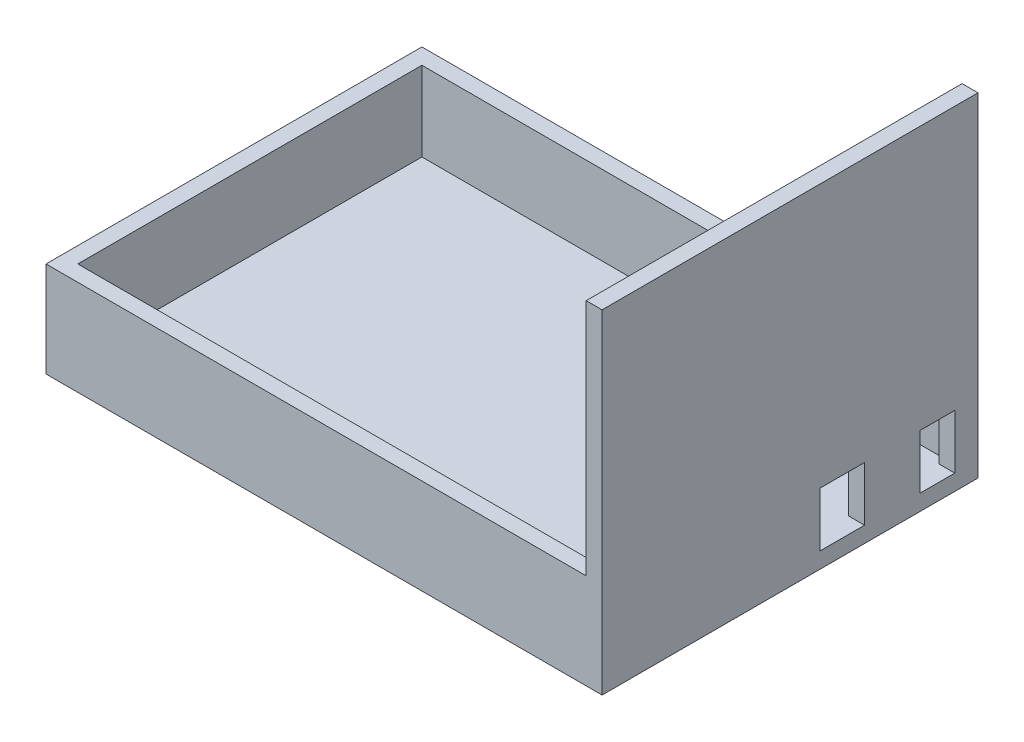
from build123d import *

# Parameters (mm, degrees)
SZKIC1_W                    = 175
SZKIC1_H                    = 118.3
DODANIE_WYCI_GNI_CIE1_DEPTH = 5
SZKIC2_W                    = 5
SZKIC2_H                    = 118.3
DODANIE_WYCI_GNI_CIE2_DEPTH = 25
SZKIC3_W                    = 5
SZKIC3_H                    = 118.3
DODANIE_WYCI_GNI_CIE3_DEPTH = 100
SZKIC4_W                    = 165
SZKIC4_H                    = 5
DODANIE_WYCI_GNI_CIE4_DEPTH = 25
SZKIC5_W                    = 165
SZKIC5_H                    = 5
DODANIE_WYCI_GNI_CIE5_DEPTH = 25
WYTNIJ_WYCI_GNI_CIE1_REACH  = 214.482
SZKIC7_W                    = 14
SZKIC7_H                    = 17.1
WYTNIJ_WYCI_GNI_CIE2_REACH  = 214.482
SZKIC8_W                    = 10.9
SZKIC8_H                    = 17.1


with BuildPart() as part:
    # Szkic1 → Dodanie-wyciągnięcie1 (new body)
    with BuildSketch(Plane(origin=(0, 0, 0), x_dir=(1, 0, 0), z_dir=(0, 1, 0))):
        Rectangle(SZKIC1_W, SZKIC1_H)
    extrude(amount=DODANIE_WYCI_GNI_CIE1_DEPTH)

    # Szkic2 → Dodanie-wyciągnięcie2 (add)
    with BuildSketch(Plane(origin=(0, 5, 0), x_dir=(1, 0, 0), z_dir=(0, 1, 0))):
        with Locations((-85, 0)):
            Rectangle(SZKIC2_W, SZKIC2_H)
    extrude(amount=DODANIE_WYCI_GNI_CIE2_DEPTH)

    # Szkic3 → Dodanie-wyciągnięcie3 (add)
    with BuildSketch(Plane(origin=(0, 5, 0), x_dir=(1, 0, 0), z_dir=(0, 1, 0))):
        with Locations((85, 0)):
            Rectangle(SZKIC3_W, SZKIC3_H)
    extrude(amount=DODANIE_WYCI_GNI_CIE3_DEPTH)

    # Szkic4 → Dodanie-wyciągnięcie4 (add)
    with BuildSketch(Plane(origin=(0, 5, 0), x_dir=(1, 0, 0), z_dir=(0, 1, 0))):
        with Locations((0, -56.65)):
            Rectangle(SZKIC4_W, SZKIC4_H)
    extrude(amount=DODANIE_WYCI_GNI_CIE4_DEPTH)

    # Szkic5 → Dodanie-wyciągnięcie5 (add)
    with BuildSketch(Plane(origin=(0, 5, 0), x_dir=(1, 0, 0), z_dir=(0, 1, 0))):
        with Locations((0, 56.65)):
            Rectangle(SZKIC5_W, SZKIC5_H)
    extrude(amount=DODANIE_WYCI_GNI_CIE5_DEPTH)

    # Szkic7 → Wytnij-wyciągnięcie1 (cut, up to next)
    with BuildSketch(Plane(origin=(87.5, 0, 0), x_dir=(0, 0, -1), z_dir=(1, 0, 0)), mode=Mode.PRIVATE) as wytnij_wyci_gni_cie1_sk1:
        with Locations((16.45, 13.55)):
            Rectangle(SZKIC7_W, SZKIC7_H)
    wytnij_wyci_gni_cie1_tool1 = extrude(wytnij_wyci_gni_cie1_sk1.sketch, amount=-WYTNIJ_WYCI_GNI_CIE1_REACH, mode=Mode.PRIVATE) & part.part
    add(wytnij_wyci_gni_cie1_tool1.solids().sort_by_distance((87.5, 13.55, -16.45))[0], mode=Mode.SUBTRACT)

    # Szkic8 → Wytnij-wyciągnięcie2 (cut, up to next)
    with BuildSketch(Plane(origin=(87.5, 0, 0), x_dir=(0, 0, -1), z_dir=(1, 0, 0)), mode=Mode.PRIVATE) as wytnij_wyci_gni_cie2_sk1:
        with Locations((46.4, 13.55)):
            Rectangle(SZKIC8_W, SZKIC8_H)
    wytnij_wyci_gni_cie2_tool1 = extrude(wytnij_wyci_gni_cie2_sk1.sketch, amount=-WYTNIJ_WYCI_GNI_CIE2_REACH, mode=Mode.PRIVATE) & part.part
    add(wytnij_wyci_gni_cie2_tool1.solids().sort_by_distance((87.5, 13.55, -46.4))[0], mode=Mode.SUBTRACT)


solid = part.part
